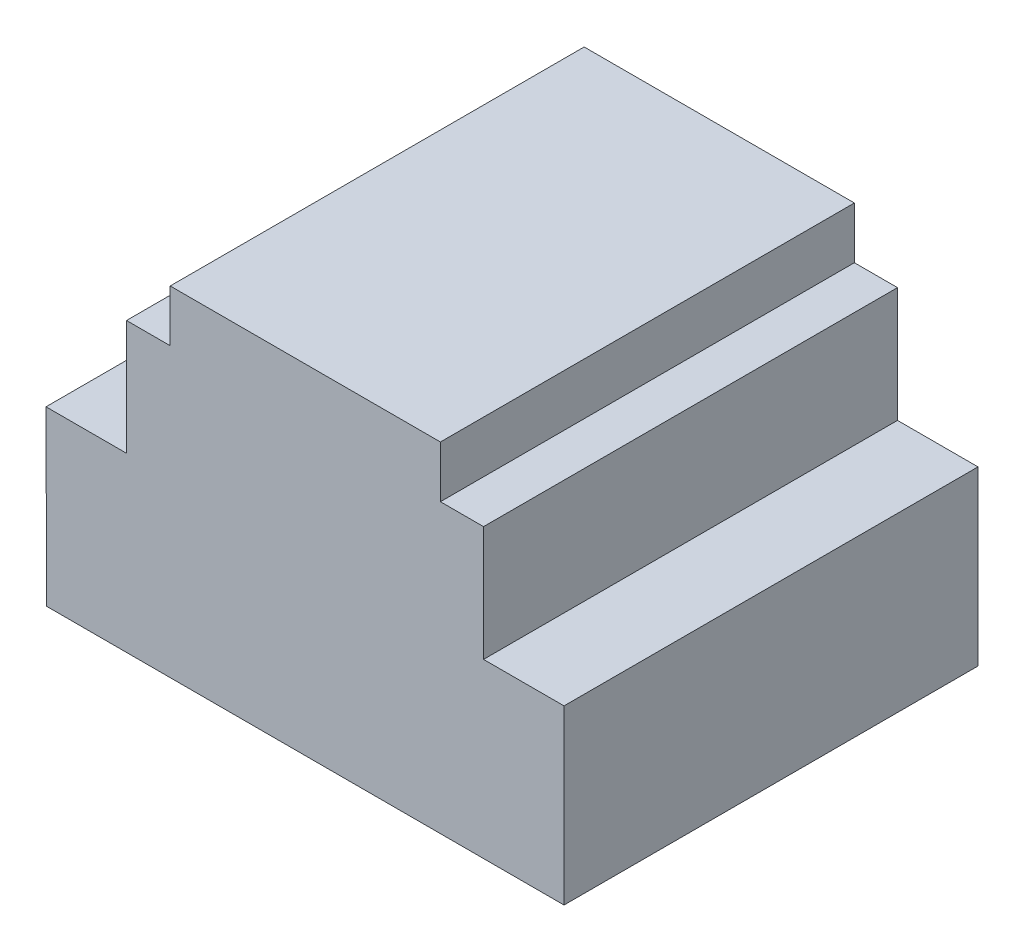
from build123d import *

# Parameters (mm, degrees)
EXTRUDE_1_DEPTH = 72


with BuildPart() as part:
    # 草图1 → 凸台-拉伸1 (new body)
    with BuildSketch(Plane.XY):
        Polygon((0, 0), (90, 0), (90, 30), (76, 30), (76, 50), (68.5, 50), (68.5, 59), (21.5, 59), (21.5, 50), (13.9, 50), (13.9, 30), (-0.1, 30), align=None)
    extrude(amount=EXTRUDE_1_DEPTH)


solid = part.part
